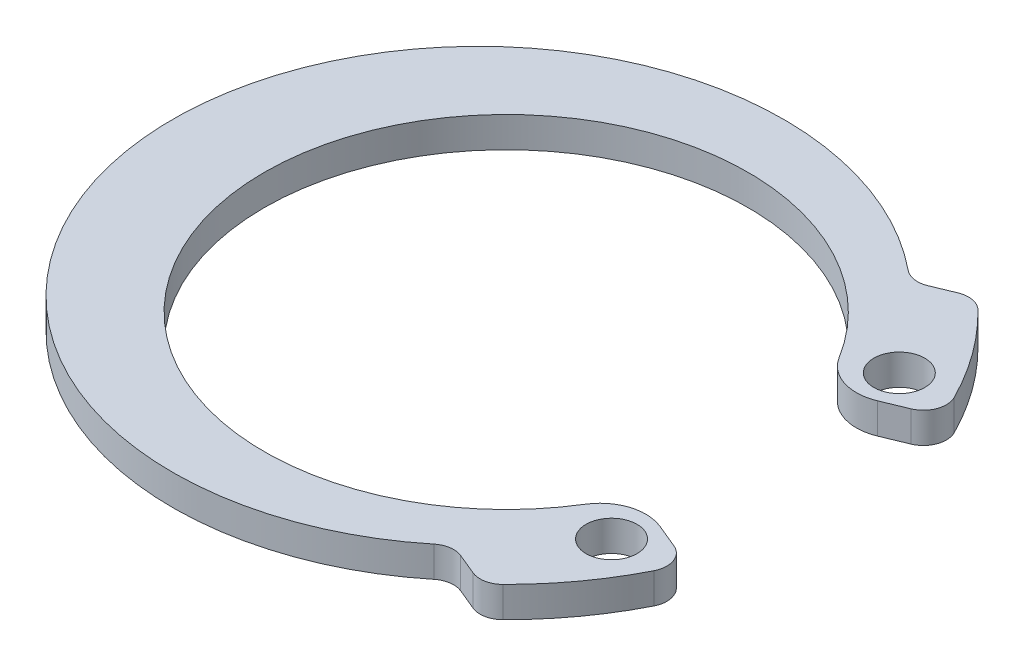
from build123d import *

# Parameters (mm, degrees)
BOSS_EXTRUDE1_DEPTH      = 0.3
BOSS_EXTRUDE1_DEPTH_BACK = 0.3
SKETCH3_R                = 0.5


with BuildPart() as part:
    # Sketch3 → Boss-Extrude1 (new, two sides: drawn at the far end of the back side and taken through both)
    with BuildSketch(Plane(origin=(0, 0, 0), x_dir=(1, 0, 0), z_dir=(0, 1, 0)).offset(-BOSS_EXTRUDE1_DEPTH_BACK)):
        with BuildLine():
            Line((3.693658944, 4.587721595), (4.109887139, 4.760128959))
            ThreePointArc((4.109887139, 4.760128959), (4.368291366, 4.786050614), (4.597986914, 4.664870452))
            ThreePointArc((4.597986914, 4.664870452), (5.294209507, 3.856662507), (5.850010947, 2.946162236))
            ThreePointArc((5.850010947, 2.946162236), (5.869920538, 2.587009287), (5.620309342, 2.328008354))
            Line((5.620309342, 2.328008354), (5.153268852, 2.134553849))
            ThreePointArc((5.153268852, 2.134553849), (4.531977259, 2.109693047), (4.042841659, 2.493578015))
            ThreePointArc((4.042841659, 2.493578015), (-4.75, 0), (4.042841659, -2.493578015))
            ThreePointArc((4.042841659, -2.493578015), (4.531977259, -2.109693047), (5.153268852, -2.134553849))
            Line((5.153268852, -2.134553849), (5.620309342, -2.328008354))
            ThreePointArc((5.620309342, -2.328008354), (5.869920538, -2.587009287), (5.850010947, -2.946162236))
            ThreePointArc((5.850010947, -2.946162236), (5.294209507, -3.856662507), (4.597986914, -4.664870452))
            ThreePointArc((4.597986914, -4.664870452), (4.368291366, -4.786050614), (4.109887139, -4.760128959))
            Line((4.109887139, -4.760128959), (3.693658944, -4.587721595))
            ThreePointArc((3.693658944, -4.587721595), (3.456361984, -4.558199636), (3.237444795, -4.65441116))
            ThreePointArc((3.237444795, -4.65441116), (-6.55, 0), (3.237444795, 4.65441116))
            ThreePointArc((3.237444795, 4.65441116), (3.456361984, 4.558199636), (3.693658944, 4.587721595))
        make_face()
        with Locations(Location((4.893043531, -2.825, 0), (0, 0, 270))):
            Circle(SKETCH3_R, mode=Mode.SUBTRACT)
        with Locations(Location((4.893043531, 2.825, 0), (0, 0, 270))):
            Circle(SKETCH3_R, mode=Mode.SUBTRACT)
    extrude(amount=BOSS_EXTRUDE1_DEPTH + BOSS_EXTRUDE1_DEPTH_BACK)


solid = part.part
